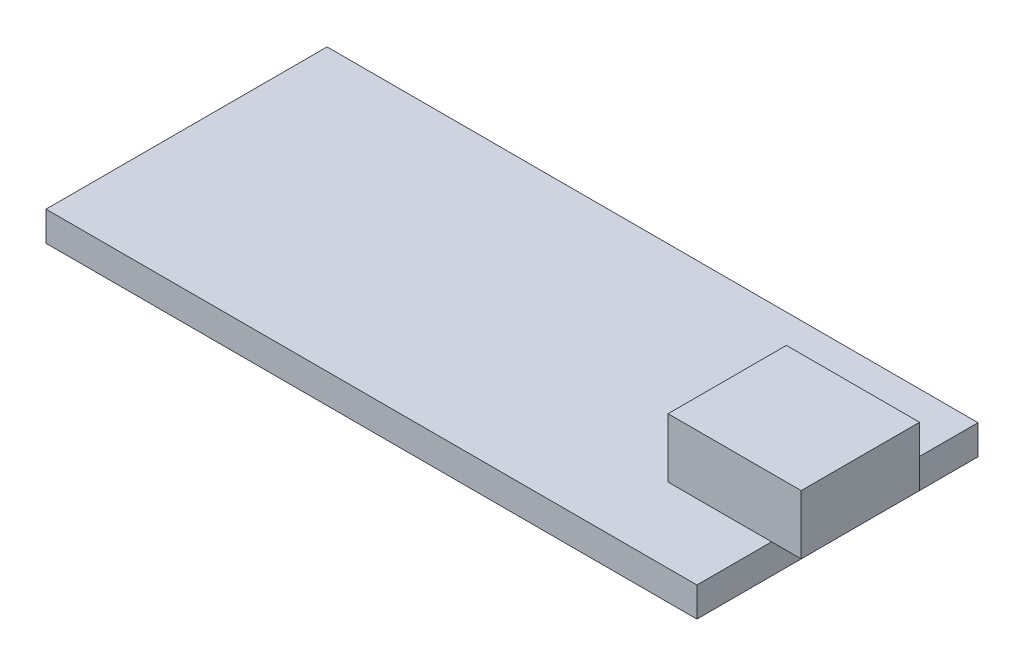
from build123d import *

# Parameters (mm, degrees)
SKETCH_1_W      = 44
SKETCH_1_H      = 19
EXTRUDE_1_DEPTH = 2
SKETCH_2_W      = 9
SKETCH_2_H      = 8
EXTRUDE_2_DEPTH = 4


with BuildPart() as part:
    # 草图1 → 凸台-拉伸1 (new body)
    with BuildSketch(Plane(origin=(0, 0, 0), x_dir=(1, 0, 0), z_dir=(0, 1, 0))):
        Rectangle(SKETCH_1_W, SKETCH_1_H)
    extrude(amount=EXTRUDE_1_DEPTH)

    # 草图2 → 凸台-拉伸2 (add)
    with BuildSketch(Plane(origin=(0, 2, 0), x_dir=(1, 0, 0), z_dir=(0, 1, 0))):
        with Locations((19.5, -0.451163062)):
            Rectangle(SKETCH_2_W, SKETCH_2_H)
    extrude(amount=EXTRUDE_2_DEPTH)


solid = part.part
